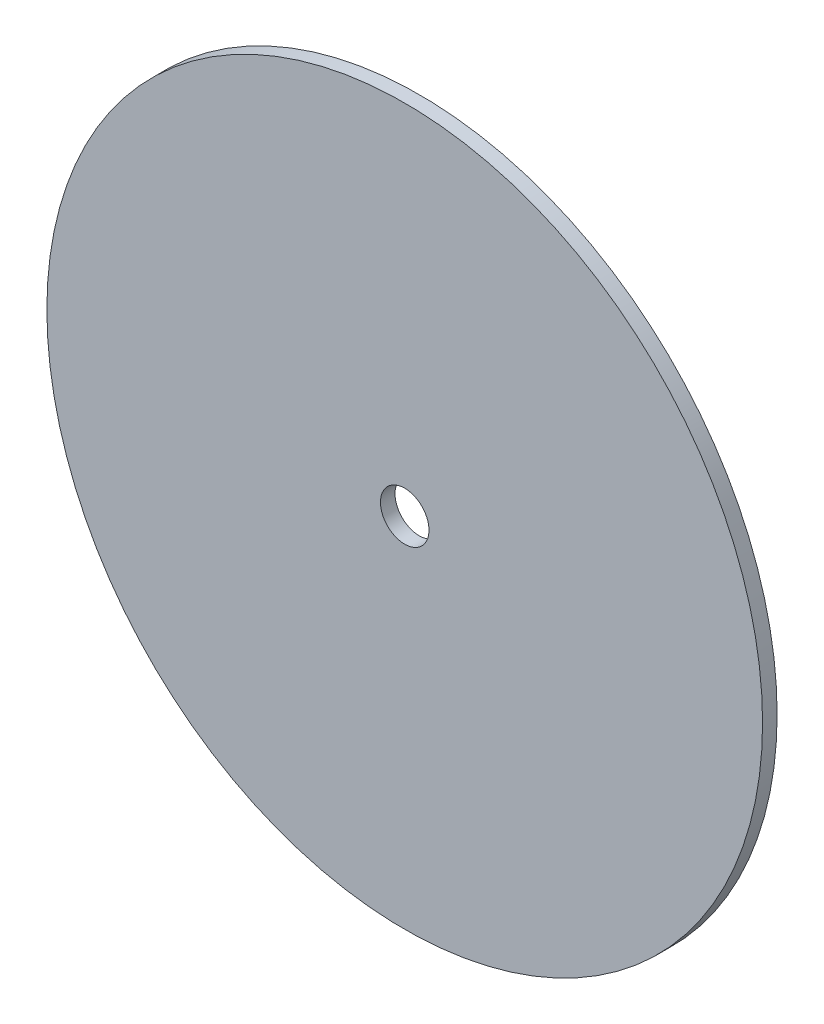
from build123d import *

# Parameters (mm, degrees)
SKETCH1_R           = 29.5
BOSS_EXTRUDE1_DEPTH = 1.2
SKETCH2_R           = 2
CUT_EXTRUDE1_DEPTH  = 1.2


with BuildPart() as part:
    # Sketch1 → Boss-Extrude1 (new body)
    with BuildSketch(Plane.XY):
        Circle(SKETCH1_R)
    extrude(amount=BOSS_EXTRUDE1_DEPTH)

    # Sketch2 → Cut-Extrude1 (cut)
    with BuildSketch(Plane(origin=(0, 0, 0), x_dir=(-1, 0, 0), z_dir=(0, 0, -1))):
        Circle(SKETCH2_R)
    extrude(amount=-CUT_EXTRUDE1_DEPTH, mode=Mode.SUBTRACT)


solid = part.part
